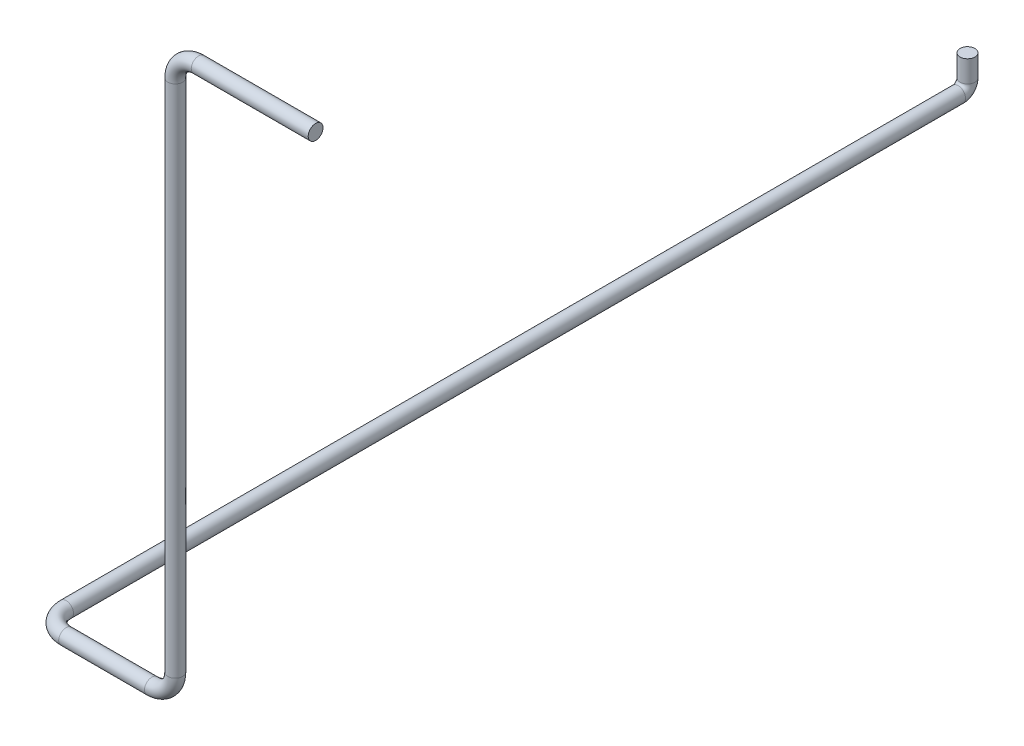
from build123d import *

# Parameters (mm, degrees)
CROQUIS1_R              = 9.525
SALIENTE_EXTRUIR1_DEPTH = 10
CROQUIS2_R              = 9.525


with BuildPart() as part:
    # Croquis1 → Saliente-Extruir1 (new body)
    with BuildSketch(Plane(origin=(0, 0, 0), x_dir=(1, 0, 0), z_dir=(0, 1, 0))):
        with Locations(Location((0, 0, 0), (0, 0, 270))):
            Circle(CROQUIS1_R)
    extrude(amount=-SALIENTE_EXTRUIR1_DEPTH)

    # Barrer1: sweep along a curve in space
    with BuildLine() as barrer1_path:
        Line((0, -10, 0), (0, -28, 0))
        ThreePointArc((0, -28, 0), (0, -36.485281374, 3.514718626), (0, -40, 12))
        Line((0, -40, 12), (0, -40, 1156))
        ThreePointArc((0, -40, 1156), (8.786796564, -40, 1177.213203436), (30, -40, 1186))
        Line((30, -40, 1186), (140, -40, 1186))
        ThreePointArc((140, -40, 1186), (161.213203436, -31.213203436, 1186), (170, -10, 1186))
        Line((170, -10, 1186), (170, 650, 1186))
        ThreePointArc((170, 650, 1186), (178.786796564, 671.213203436, 1186), (200, 680, 1186))
        Line((200, 680, 1186), (350, 680, 1186))
    # Croquis2 → Barrer1 (sweep)
    with BuildSketch(Plane.XZ.offset(10)):
        Circle(CROQUIS2_R)
    sweep(path=barrer1_path.line)


solid = part.part
